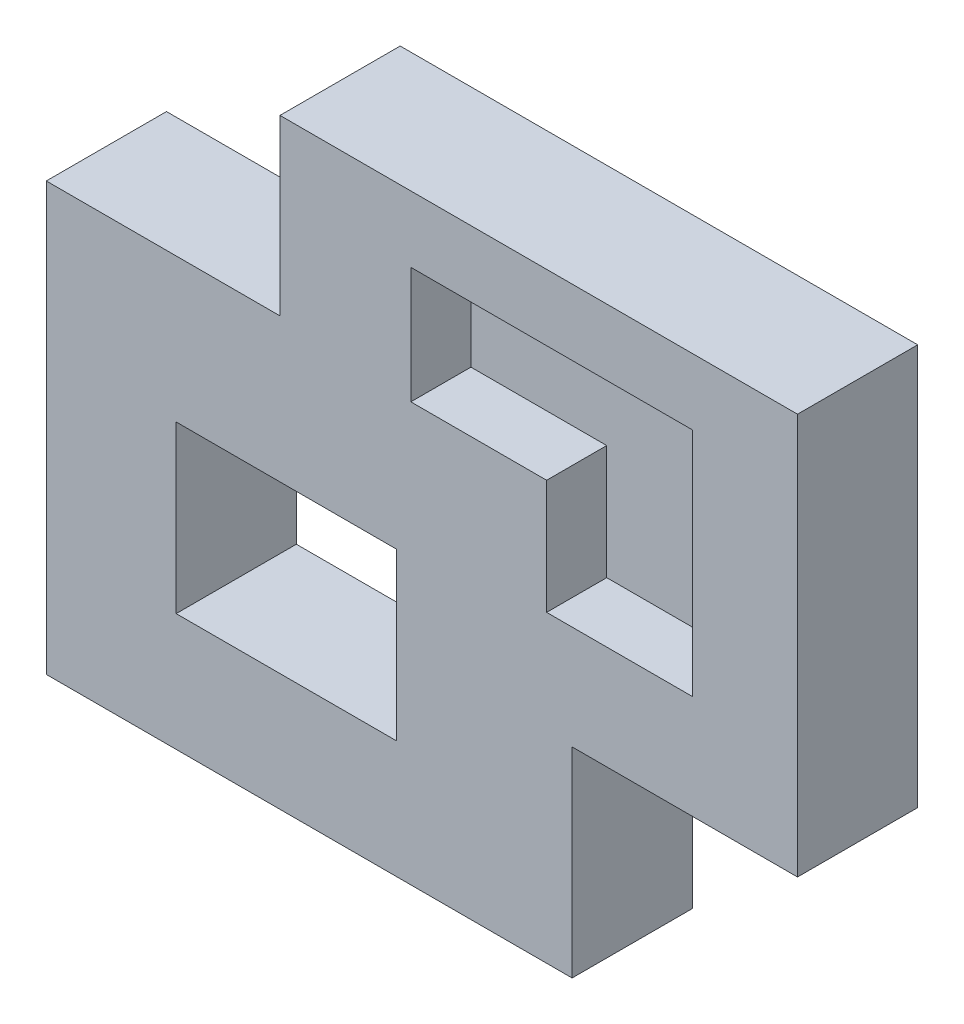
from build123d import *

# Parameters (mm, degrees)
EXTRUDE1_DEPTH     = 20
SKETCH2_W          = 36.686074526
SKETCH2_H          = 27.619463242
CUT_EXTRUDE1_DEPTH = 20
CUT_EXTRUDE2_DEPTH = 10


with BuildPart() as part:
    # Sketch1 → Extrude1 (new body)
    with BuildSketch(Plane.XY):
        Polygon((0, 0), (87.492525773, 0), (87.492525773, 33.304768041), (125, 33.304768041), (125, 100), (38.88556701, 100), (38.88556701, 71.110180412), (0, 71.110180412), align=None)
    extrude(amount=EXTRUDE1_DEPTH)

    # Sketch2 → Cut-Extrude1 (cut)
    with BuildSketch(Plane.XY.offset(20)):
        with Locations((39.952253424, 33.375570886)):
            Rectangle(SKETCH2_W, SKETCH2_H)
    extrude(amount=-CUT_EXTRUDE1_DEPTH, mode=Mode.SUBTRACT)

    # Sketch3 → Cut-Extrude2 (cut)
    with BuildSketch(Plane.XY.offset(20)):
        Polygon((60.658966885, 88.995285907), (107.488557574, 88.995285907), (107.488557574, 50.5688125), (83.253213497, 50.5688125), (83.253213497, 69.608647213), (60.658966885, 69.608647213), align=None)
    extrude(amount=-CUT_EXTRUDE2_DEPTH, mode=Mode.SUBTRACT)


solid = part.part
